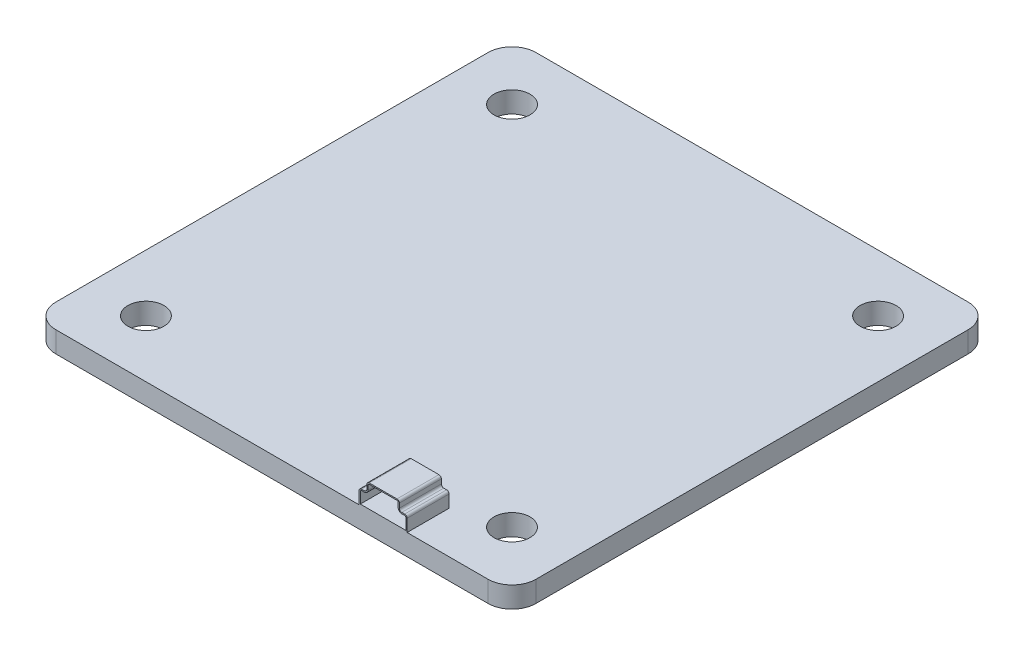
from build123d import *

# Parameters (mm, degrees)
SKETCH1_R           = 1.5
BOSS_EXTRUDE1_DEPTH = 1.75
BOSS_EXTRUDE2_DEPTH = 3
BOSS_EXTRUDE3_DEPTH = 0.5
SKETCH4_R           = 0.26
CUT_EXTRUDE1_DEPTH  = 42.78890403


with BuildPart() as part:
    # Sketch1 → Boss-Extrude1 (new body)
    with BuildSketch(Plane(origin=(0, 0, 0), x_dir=(1, 0, 0), z_dir=(0, 1, 0))):
        with BuildLine():
            Line((-18, 20), (18, 20))
            ThreePointArc((18, 20), (19.414213562, 19.414213562), (20, 18))
            Line((20, 18), (20, -18))
            ThreePointArc((20, -18), (19.414213562, -19.414213562), (18, -20))
            Line((18, -20), (-18, -20))
            ThreePointArc((-18, -20), (-19.414213562, -19.414213562), (-20, -18))
            Line((-20, -18), (-20, 18))
            ThreePointArc((-20, 18), (-19.414213562, 19.414213562), (-18, 20))
        make_face()
        with Locations(Location((-15.25, 15.25, 0), (0, 0, 270))):
            Circle(SKETCH1_R, mode=Mode.SUBTRACT)
        with Locations(Location((15.25, 15.25, 0), (0, 0, 270))):
            Circle(SKETCH1_R, mode=Mode.SUBTRACT)
        with Locations(Location((15.25, -15.25, 0), (0, 0, 270))):
            Circle(SKETCH1_R, mode=Mode.SUBTRACT)
        with Locations(Location((-15.25, -15.25, 0), (0, 0, 270))):
            Circle(SKETCH1_R, mode=Mode.SUBTRACT)
    extrude(amount=BOSS_EXTRUDE1_DEPTH)

    # Sketch2 → Boss-Extrude2 (add)
    with BuildSketch(Plane.XY.offset(20)):
        with BuildLine():
            Line((7.26, 1.75), (7.26, 2.78))
            ThreePointArc((7.26, 2.78), (7.318578644, 2.921421356), (7.46, 2.98))
            Line((7.46, 2.98), (7.705, 2.98))
            ThreePointArc((7.705, 2.98), (7.846421356, 3.038578644), (7.905, 3.18))
            Line((7.905, 3.18), (7.905, 3.55))
            ThreePointArc((7.905, 3.55), (7.963578644, 3.691421356), (8.105, 3.75))
            Line((8.105, 3.75), (10.415, 3.75))
            ThreePointArc((10.415, 3.75), (10.556421356, 3.691421356), (10.615, 3.55))
            Line((10.615, 3.55), (10.615, 3.18))
            ThreePointArc((10.615, 3.18), (10.673578644, 3.038578644), (10.815, 2.98))
            Line((10.815, 2.98), (11.06, 2.98))
            ThreePointArc((11.06, 2.98), (11.201421356, 2.921421356), (11.26, 2.78))
            Line((11.26, 2.78), (11.26, 1.75))
            Line((11.26, 1.75), (7.26, 1.75))
        make_face()
        with BuildLine():
            Line((7.36, 1.85), (7.36, 2.78))
            ThreePointArc((7.36, 2.78), (7.389289322, 2.850710678), (7.46, 2.88))
            Line((7.46, 2.88), (7.705, 2.88))
            ThreePointArc((7.705, 2.88), (7.917132034, 2.967867966), (8.005, 3.18))
            Line((8.005, 3.18), (8.005, 3.55))
            ThreePointArc((8.005, 3.55), (8.034289322, 3.620710678), (8.105, 3.65))
            Line((8.105, 3.65), (10.415, 3.65))
            ThreePointArc((10.415, 3.65), (10.485710678, 3.620710678), (10.515, 3.55))
            Line((10.515, 3.55), (10.515, 3.18))
            ThreePointArc((10.515, 3.18), (10.602867966, 2.967867966), (10.815, 2.88))
            Line((10.815, 2.88), (11.06, 2.88))
            ThreePointArc((11.06, 2.88), (11.130710678, 2.850710678), (11.16, 2.78))
            Line((11.16, 2.78), (11.16, 1.85))
            Line((11.16, 1.85), (7.36, 1.85))
        make_face(mode=Mode.SUBTRACT)
    extrude(amount=-BOSS_EXTRUDE2_DEPTH)

    # Sketch3 → Boss-Extrude3 (add)
    with BuildSketch(Plane(origin=(0, 0, 17), x_dir=(-1, 0, 0), z_dir=(0, 0, -1))):
        with BuildLine():
            Line((-11.26, 1.75), (-7.26, 1.75))
            Line((-7.26, 1.75), (-7.26, 2.78))
            ThreePointArc((-7.26, 2.78), (-7.318578644, 2.921421356), (-7.46, 2.98))
            Line((-7.46, 2.98), (-7.705, 2.98))
            ThreePointArc((-7.705, 2.98), (-7.846421356, 3.038578644), (-7.905, 3.18))
            Line((-7.905, 3.18), (-7.905, 3.55))
            ThreePointArc((-7.905, 3.55), (-7.963578644, 3.691421356), (-8.105, 3.75))
            Line((-8.105, 3.75), (-10.415, 3.75))
            ThreePointArc((-10.415, 3.75), (-10.556421356, 3.691421356), (-10.615, 3.55))
            Line((-10.615, 3.55), (-10.615, 3.18))
            ThreePointArc((-10.615, 3.18), (-10.673578644, 3.038578644), (-10.815, 2.98))
            Line((-10.815, 2.98), (-11.06, 2.98))
            ThreePointArc((-11.06, 2.98), (-11.201421356, 2.921421356), (-11.26, 2.78))
            Line((-11.26, 2.78), (-11.26, 1.75))
        make_face()
    extrude(amount=BOSS_EXTRUDE3_DEPTH)

    # Sketch4 → Cut-Extrude1 (cut, through all)
    with BuildSketch(Plane(origin=(0, 0, 16.5), x_dir=(-1, 0, 0), z_dir=(0, 0, -1))):
        with Locations((-10.2, 2.87)):
            Circle(SKETCH4_R)
        with Locations((-9.3, 2.87)):
            Circle(SKETCH4_R)
        with Locations((-8.4, 2.87)):
            Circle(SKETCH4_R)
    extrude(amount=-CUT_EXTRUDE1_DEPTH, mode=Mode.SUBTRACT)


solid = part.part
